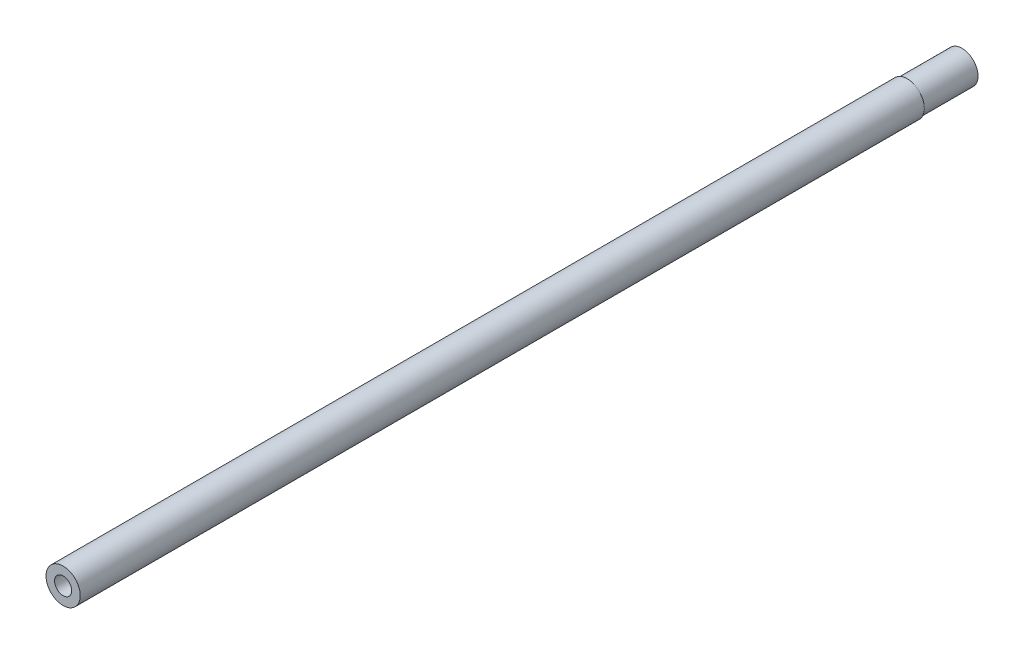
from build123d import *

# Parameters (mm, degrees)
SKETCH_1_R          = 40
SKETCH_1_R_2        = 20
EXTRUDE_1_DEPTH     = 2100
SKETCH_2_R          = 40
SKETCH_2_R_2        = 37.5
CUT_EXTRUDE_1_DEPTH = 128


with BuildPart() as part:
    # 草图1 → 凸台-拉伸1 (new body)
    with BuildSketch(Plane.XY):
        Circle(SKETCH_1_R)
        Circle(SKETCH_1_R_2, mode=Mode.SUBTRACT)
    extrude(amount=EXTRUDE_1_DEPTH)

    # 草图2 → 切除-拉伸1 (cut)
    with BuildSketch(Plane(origin=(0, 0, 0), x_dir=(-1, 0, 0), z_dir=(0, 0, -1))):
        Circle(SKETCH_2_R)
        Circle(SKETCH_2_R_2, mode=Mode.SUBTRACT)
    extrude(amount=-CUT_EXTRUDE_1_DEPTH, mode=Mode.SUBTRACT)


solid = part.part
